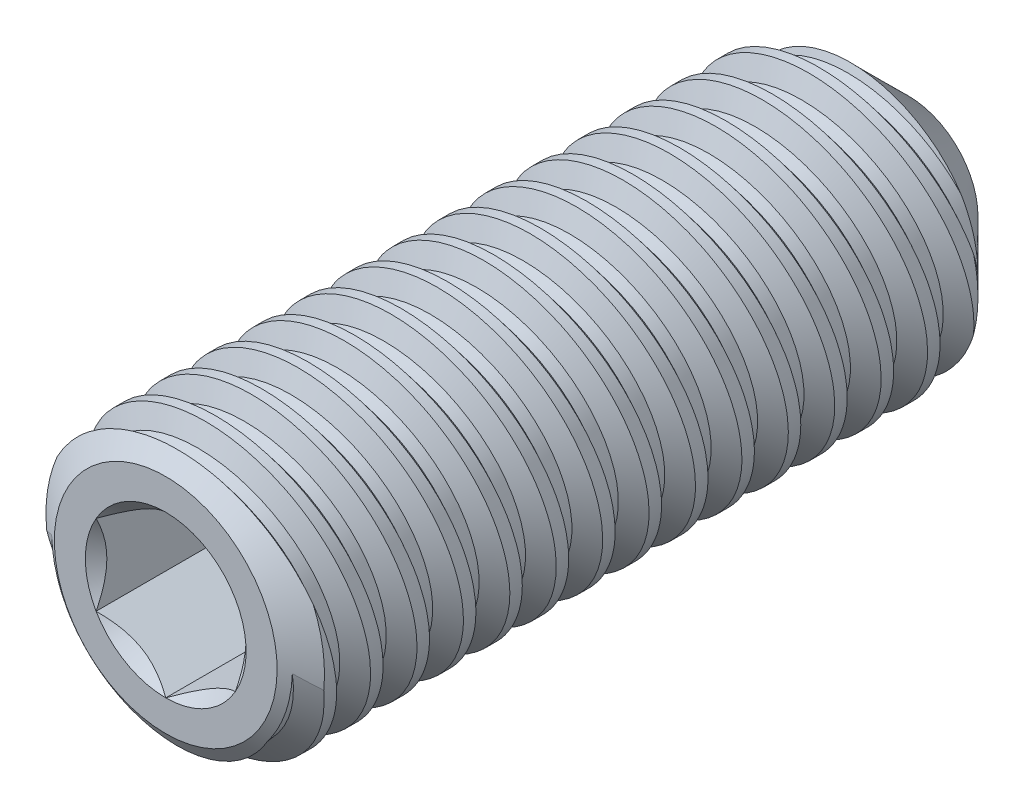
from build123d import *

# Parameters (mm, degrees)
LPATTERN1_COUNT     = 15
LPATTERN1_PITCH     = 0.5
LPATTERN1_COL_COUNT = 2
LPATTERN1_COL_PITCH = 0.5
CUT_EXTRUDE10_DEPTH = 1.5


with BuildPart() as part:
    # Sketch22 → Revolve1 (revolve)
    with BuildSketch(Plane(origin=(0, 0, 0), x_dir=(0, 0, -1), z_dir=(1, 0, 0)), mode=Mode.PRIVATE) as revolve1_sk:
        Polygon((-3.774677268, 0), (-3.774677268, 1.2), (-3.564615006, 1.5), (3.475322732, 1.5), (4.225322732, 0.75), (3.774677268, 0), align=None)
    revolve(revolve1_sk.sketch.rotate(Axis((0, 0, -3.774677268), (0, 0, -1)), 180), axis=Axis((0, 0, -3.774677268), (0, 0, -1)))

    # Sketch6 → Cut-Revolve8 (revolve, cut)
    with BuildSketch(Plane(origin=(0, 0, 0), x_dir=(0, 0, -1), z_dir=(1, 0, 0))):
        Polygon((3.073757931, 1.289561466), (2.95045869, 1.269011592), (2.751842859, 1.510274937), (3.1833902, 1.582199494), align=None)
    cut_revolve8 = revolve(axis=Axis((0, 0.089188249, -3.760452226), (0, -0.1643989873052489, 0.9863939238321618)), mode=Mode.SUBTRACT)

    # LPattern1: Cut-Revolve8 ×15
    with Locations(*[(0, 0, i * LPATTERN1_PITCH) for i in range(1, LPATTERN1_COUNT)]):
        add(cut_revolve8, mode=Mode.SUBTRACT)

    # LPattern1 col: Cut-Revolve8 ×2
    with Locations(*[(0, 0, -i * LPATTERN1_COL_PITCH) for i in range(1, LPATTERN1_COL_COUNT)]):
        add(cut_revolve8, mode=Mode.SUBTRACT)

    # Sketch23 → Cut-Extrude10 (cut)
    with BuildSketch(Plane.XY.offset(3.774677268)):
        Polygon((0, 0.866025404), (-0.75, 0.433012702), (-0.75, -0.433012702), (0, -0.866025404), (0.75, -0.433012702), (0.75, 0.433012702), align=None)
    extrude(amount=-CUT_EXTRUDE10_DEPTH, mode=Mode.SUBTRACT)

    # Cut-Extrude11 cone 1 section (through the dimple's axis) → Cut-Extrude11 (revolve, cut)
    with BuildSketch(Plane(origin=(0, 0, 3.774677268), x_dir=(0, -1, 0), z_dir=(1, 0, 0))):
        Polygon((0, 0), (0.866025404, 0), (0, 0.866025404), align=None)
    revolve(axis=Axis((0, 0, 3.774677268), (0, 0, -1)), mode=Mode.SUBTRACT)

    # Cut-Extrude12 cone 1 section (through the dimple's axis) → Cut-Extrude12 (revolve, cut)
    with BuildSketch(Plane(origin=(0, 0, 2.274677268), x_dir=(0, -1, 0), z_dir=(1, 0, 0))):
        Polygon((0, 0), (0.75, 0), (0, 0.450645464), align=None)
    revolve(axis=Axis((0, 0, 2.274677268), (0, 0, -1)), mode=Mode.SUBTRACT)


solid = part.part
